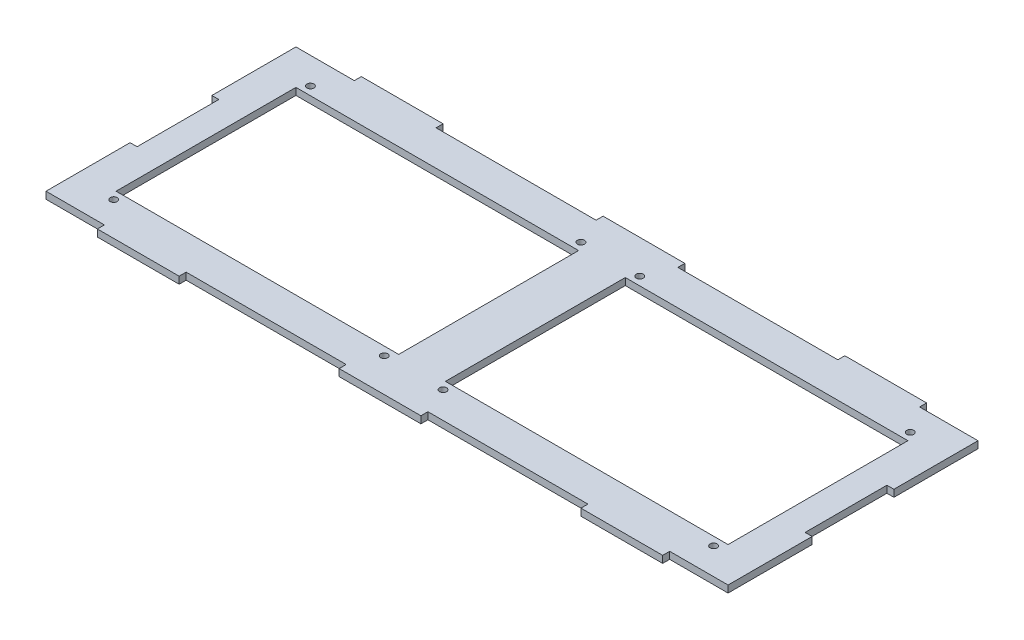
from build123d import *

# Parameters (mm, degrees)
SKETCH1_W           = 292
SKETCH1_H           = 107
BOSS_EXTRUDE1_DEPTH = 3
SKETCH2_W           = 121
SKETCH2_H           = 77
CUT_EXTRUDE2_DEPTH  = 3
SKETCH3_W           = 121
SKETCH3_H           = 77
CUT_EXTRUDE3_DEPTH  = 3
SKETCH8_W           = 3
SKETCH8_H           = 35
CUT_EXTRUDE7_DEPTH  = 3
SKETCH4_W           = 35
SKETCH4_H           = 3
BOSS_EXTRUDE2_DEPTH = 3
SKETCH7_W           = 35
SKETCH7_H           = 3
BOSS_EXTRUDE3_DEPTH = 3
SKETCH9_R           = 1.5
CUT_EXTRUDE8_DEPTH  = 10


with BuildPart() as part:
    # Sketch1 → Boss-Extrude1 (new body)
    with BuildSketch(Plane(origin=(0, 0, 0), x_dir=(1, 0, 0), z_dir=(0, 1, 0))):
        Rectangle(SKETCH1_W, SKETCH1_H)
    extrude(amount=BOSS_EXTRUDE1_DEPTH)

    # Sketch2 → Cut-Extrude2 (cut)
    with BuildSketch(Plane(origin=(0, 3, 0), x_dir=(1, 0, 0), z_dir=(0, 1, 0))):
        with Locations((-70.5, 0)):
            Rectangle(SKETCH2_W, SKETCH2_H)
    extrude(amount=-CUT_EXTRUDE2_DEPTH, mode=Mode.SUBTRACT)

    # Sketch3 → Cut-Extrude3 (cut)
    with BuildSketch(Plane(origin=(0, 3, 0), x_dir=(1, 0, 0), z_dir=(0, 1, 0))):
        with Locations((70.5, 0)):
            Rectangle(SKETCH3_W, SKETCH3_H)
    extrude(amount=-CUT_EXTRUDE3_DEPTH, mode=Mode.SUBTRACT)

    # Sketch8 → Cut-Extrude7 (cut)
    with BuildSketch(Plane(origin=(0, 3, 0), x_dir=(1, 0, 0), z_dir=(0, 1, 0))):
        with Locations((144.5, 0)):
            Rectangle(SKETCH8_W, SKETCH8_H)
        with Locations((-144.5, 0)):
            Rectangle(SKETCH8_W, SKETCH8_H)
    extrude(amount=-CUT_EXTRUDE7_DEPTH, mode=Mode.SUBTRACT)

    # Sketch4 → Boss-Extrude2 (add)
    with BuildSketch(Plane(origin=(0, 3, 0), x_dir=(1, 0, 0), z_dir=(0, 1, 0))):
        with Locations((-103.5, -55)):
            Rectangle(SKETCH4_W, SKETCH4_H)
        with Locations((-103.5, 55)):
            Rectangle(SKETCH4_W, SKETCH4_H)
        with Locations((103.5, 55)):
            Rectangle(SKETCH4_W, SKETCH4_H)
        with Locations((103.5, -55)):
            Rectangle(SKETCH4_W, SKETCH4_H)
    extrude(amount=-BOSS_EXTRUDE2_DEPTH)

    # Sketch7 → Boss-Extrude3 (add)
    with BuildSketch(Plane(origin=(0, 3, 0), x_dir=(1, 0, 0), z_dir=(0, 1, 0))):
        with Locations((0, -55)):
            Rectangle(SKETCH7_W, SKETCH7_H)
        with Locations((0, 55)):
            Rectangle(SKETCH7_W, SKETCH7_H)
    extrude(amount=-BOSS_EXTRUDE3_DEPTH)

    # Sketch9 → Cut-Extrude8 (cut)
    with BuildSketch(Plane(origin=(0, 3, 0), x_dir=(1, 0, 0), z_dir=(0, 1, 0))):
        with Locations(Location((-128.4, -42.1, 0), (0, 0, 270))):
            Circle(SKETCH9_R)
        with Locations(Location((-12.6, -42.1, 0), (0, 0, 270))):
            Circle(SKETCH9_R)
        with Locations(Location((-12.6, 42.1, 0), (0, 0, 270))):
            Circle(SKETCH9_R)
        with Locations(Location((-128.4, 42.1, 0), (0, 0, 270))):
            Circle(SKETCH9_R)
        with Locations(Location((12.6, -42.1, 0), (0, 0, 270))):
            Circle(SKETCH9_R)
        with Locations(Location((128.4, -42.1, 0), (0, 0, 270))):
            Circle(SKETCH9_R)
        with Locations(Location((128.4, 42.1, 0), (0, 0, 270))):
            Circle(SKETCH9_R)
        with Locations(Location((12.6, 42.1, 0), (0, 0, 270))):
            Circle(SKETCH9_R)
    extrude(amount=-CUT_EXTRUDE8_DEPTH, mode=Mode.SUBTRACT)


solid = part.part
